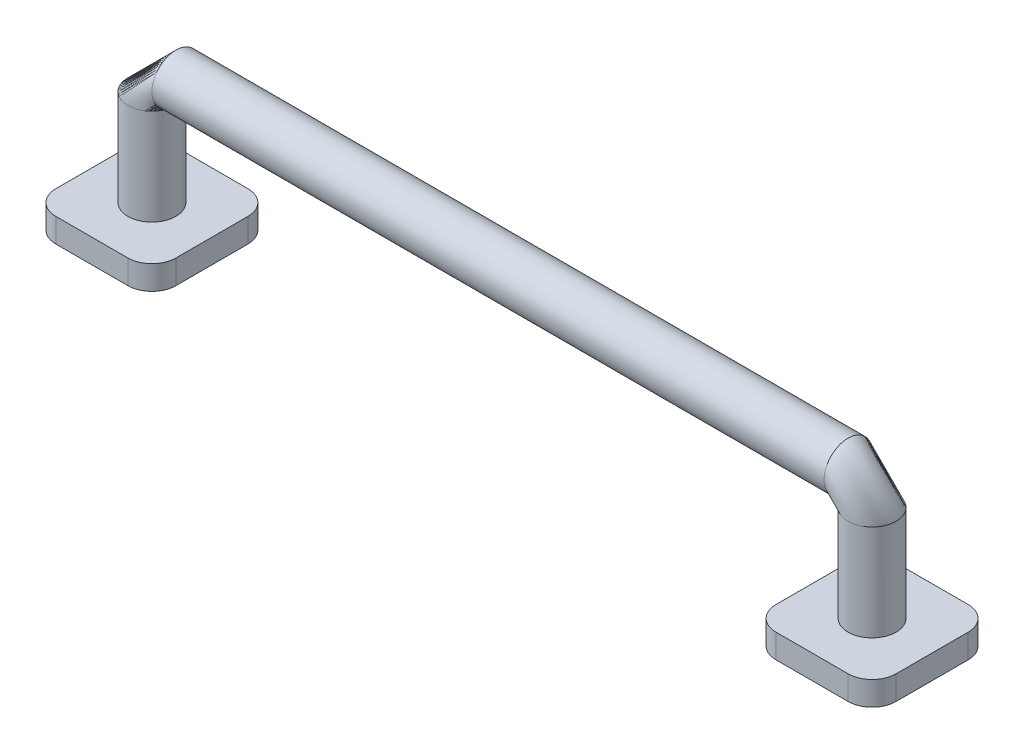
from build123d import *

# Parameters (mm, degrees)
SWEEP1_PROFILE_R    = 100
BOSS_EXTRUDE1_DEPTH = 100


with BuildPart() as part:
    # Sweep1: sweep along a path in Sketch1
    with BuildLine(Plane.XY) as sweep1_path:
        Line((1535.337124289, 0), (1535.337124289, 400))
        ThreePointArc((1535.337124289, 400), (1506.047802408, 470.710678119), (1435.337124289, 500))
        Line((1435.337124289, 500), (-1364.662875711, 500))
        ThreePointArc((-1364.662875711, 500), (-1435.373553829, 470.710678119), (-1464.662875711, 400))
        Line((-1464.662875711, 400), (-1464.662875711, 0))
    # Sweep1 profile (on start of the path) → Sweep1 (sweep)
    with BuildSketch(Plane(origin=(1535.337124289, 0, 0), x_dir=(0, 0, 1), z_dir=(0, 1, 0))):
        Circle(SWEEP1_PROFILE_R)
    sweep(path=sweep1_path.line)

    # Sketch79 → Boss-Extrude1 (add)
    with BuildSketch(Plane.XZ):
        with BuildLine():
            Line((-1614.662875711, 250), (-1314.662875711, 250))
            ThreePointArc((-1314.662875711, 250), (-1243.952197592, 220.710678119), (-1214.662875711, 150))
            Line((-1214.662875711, 150), (-1214.662875711, -150))
            ThreePointArc((-1214.662875711, -150), (-1243.952197592, -220.710678119), (-1314.662875711, -250))
            Line((-1314.662875711, -250), (-1614.662875711, -250))
            ThreePointArc((-1614.662875711, -250), (-1685.373553829, -220.710678119), (-1714.662875711, -150))
            Line((-1714.662875711, -150), (-1714.662875711, 150))
            ThreePointArc((-1714.662875711, 150), (-1685.373553829, 220.710678119), (-1614.662875711, 250))
        make_face()
        with BuildLine():
            Line((1385.337124289, 250), (1685.337124289, 250))
            ThreePointArc((1685.337124289, 250), (1756.047802408, 220.710678119), (1785.337124289, 150))
            Line((1785.337124289, 150), (1785.337124289, -150))
            ThreePointArc((1785.337124289, -150), (1756.047802408, -220.710678119), (1685.337124289, -250))
            Line((1685.337124289, -250), (1385.337124289, -250))
            ThreePointArc((1385.337124289, -250), (1314.626446171, -220.710678119), (1285.337124289, -150))
            Line((1285.337124289, -150), (1285.337124289, 150))
            ThreePointArc((1285.337124289, 150), (1314.626446171, 220.710678119), (1385.337124289, 250))
        make_face()
    extrude(amount=BOSS_EXTRUDE1_DEPTH)


solid = part.part
